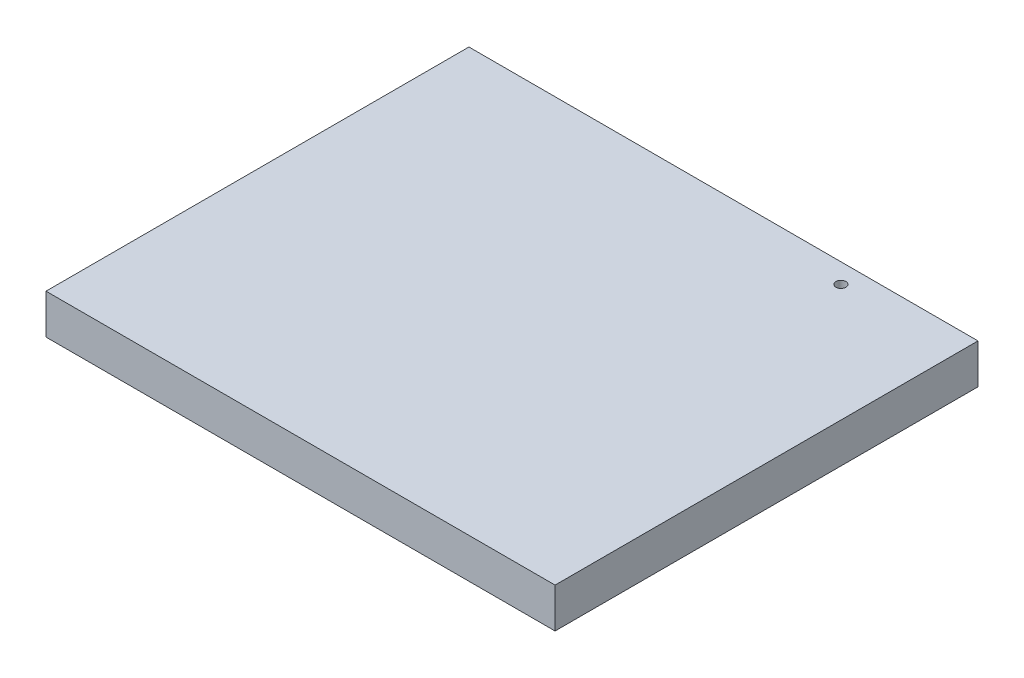
from build123d import *

# Parameters (mm, degrees)
SKETCH2_W           = 325
SKETCH2_H           = 270
BOSS_EXTRUDE1_DEPTH = 25.4
SKETCH6_R           = 3.2
CUT_EXTRUDE3_DEPTH  = 25.4


with BuildPart() as part:
    # Sketch2 → Boss-Extrude1 (new body)
    with BuildSketch(Plane(origin=(0, 0, 0), x_dir=(1, 0, 0), z_dir=(0, 1, 0))):
        with Locations((16.705601256, -25.116377771)):
            Rectangle(SKETCH2_W, SKETCH2_H)
    extrude(amount=BOSS_EXTRUDE1_DEPTH)

    # Sketch6 → Cut-Extrude3 (cut)
    with BuildSketch(Plane(origin=(0, 25.4, 0), x_dir=(1, 0, 0), z_dir=(0, 1, 0))):
        with Locations(Location((104.205601256, 97.383622229, 0), (0, 0, 270))):
            Circle(SKETCH6_R)
    extrude(amount=-CUT_EXTRUDE3_DEPTH, mode=Mode.SUBTRACT)


solid = part.part
